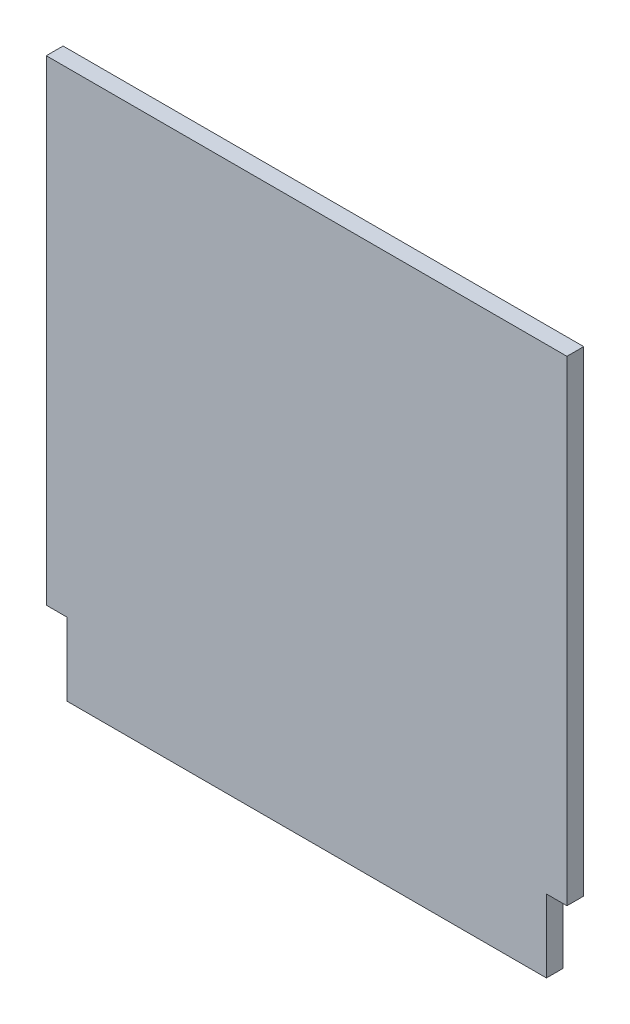
from build123d import *

# Parameters (mm, degrees)
SKETCH1_W           = 93
SKETCH1_H           = 98
BOSS_EXTRUDE1_DEPTH = 3
SKETCH2_W           = 3.658334393
SKETCH2_H           = 13
CUT_EXTRUDE1_DEPTH  = 3


with BuildPart() as part:
    # Sketch1 → Boss-Extrude1 (new body)
    with BuildSketch(Plane.XY):
        Rectangle(SKETCH1_W, SKETCH1_H)
    extrude(amount=BOSS_EXTRUDE1_DEPTH)

    # Sketch2 → Cut-Extrude1 (cut)
    with BuildSketch(Plane.XY.offset(3)):
        with Locations((-44.670832804, -42.5)):
            Rectangle(SKETCH2_W, SKETCH2_H)
        with Locations((44.670832804, -42.5)):
            Rectangle(SKETCH2_W, SKETCH2_H)
    extrude(amount=-CUT_EXTRUDE1_DEPTH, mode=Mode.SUBTRACT)


solid = part.part
